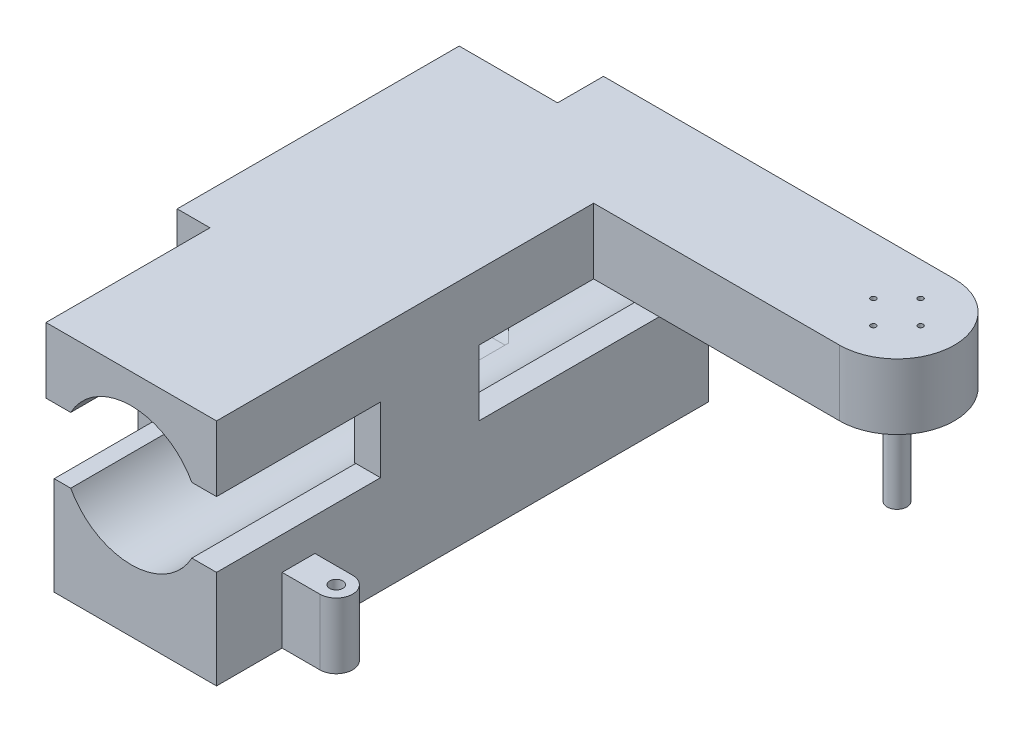
from build123d import *

# Parameters (mm, degrees)
EXTRUDE_1_DEPTH          = 140
EXTRUDE_1_DEPTH_BACK     = 10
SKETCH_2_W               = 52
SKETCH_2_H               = 70
SKETCH_3_W               = 94.267280548
SKETCH_3_H               = 20
CUT_EXTRUDE_1_DEPTH      = 50
SKETCH_4_W               = 2.5
SKETCH_4_H               = 30
CUT_EXTRUDE_2_DEPTH      = 38
EXTRUDE_2_DEPTH          = 20
CUT_EXTRUDE_7_DEPTH      = 152.678113121
CUT_EXTRUDE_7_DEPTH_BACK = 152.678113121
SKETCH_12_R              = 21
SKETCH_14_W              = 100
SKETCH_14_H              = 20
CUT_EXTRUDE_10_DEPTH     = 10
SKETCH_15_W              = 10
SKETCH_15_H              = 70
EXTRUDE_3_DEPTH          = 100
SKETCH_16_W              = 10
SKETCH_16_H              = 30
EXTRUDE_4_DEPTH          = 92
SKETCH_17_R              = 21
CUT_EXTRUDE_11_DEPTH     = 35
SKETCH_20_W              = 14
SKETCH_20_H              = 19
SKETCH_20_H_2            = 42
SKETCH_20_H_3            = 9
SKETCH_20_W_2            = 21
CUT_EXTRUDE_15_DEPTH     = 30
EXTRUDE_5_DEPTH          = 40
SKETCH_23_R              = 21
CUT_EXTRUDE_16_DEPTH     = 35
SKETCH_24_W              = 30
SKETCH_24_H              = 20
EXTRUDE_6_DEPTH          = 8
SKETCH_25_W              = 35
SKETCH_25_H              = 20
EXTRUDE_7_DEPTH          = 75
SKETCH_26_R              = 17.5
EXTRUDE_8_DEPTH          = 20
SKETCH_27_R              = 3
EXTRUDE_9_DEPTH          = 50
M2X0_4_1_D               = 1.6


with BuildPart() as part:
    # ｽｹｯﾁ2 → ﾎﾞｽ - 押し出し1 (new, two sides: drawn at the far end of the back side and taken through both)
    with BuildSketch(Plane.XY.offset(-EXTRUDE_1_DEPTH_BACK)):
        with Locations((0, -5)):
            Rectangle(SKETCH_2_W, SKETCH_2_H)
    extrude(amount=EXTRUDE_1_DEPTH + EXTRUDE_1_DEPTH_BACK)

    # ｽｹｯﾁ3 → ｶｯﾄ - 押し出し1 (cut)
    with BuildSketch(Plane.XY.offset(140)):
        Rectangle(SKETCH_3_W, SKETCH_3_H)
    extrude(amount=-CUT_EXTRUDE_1_DEPTH, mode=Mode.SUBTRACT)

    # ｽｹｯﾁ4 → ｶｯﾄ - 押し出し2 (cut)
    with BuildSketch(Plane.XY.offset(140)):
        with Locations((-24.75, -25)):
            Rectangle(SKETCH_4_W, SKETCH_4_H)
    extrude(amount=-CUT_EXTRUDE_2_DEPTH, mode=Mode.SUBTRACT)

    # ｽｹｯﾁ6 → ﾎﾞｽ - 押し出し2 (add)
    with BuildSketch(Plane(origin=(0, -40, 0), x_dir=(-1, 0, 0), z_dir=(0, -1, 0))):
        with BuildLine():
            Line((-37.5, -120), (-26, -120))
            Line((-26, -120), (-26, -110))
            Line((-26, -110), (-37.5, -110))
            ThreePointArc((-37.5, -110), (-33.964466094, -111.464466094), (-32.5, -115))
            ThreePointArc((-32.5, -115), (-33.964466094, -118.535533906), (-37.5, -120))
        make_face()
        with BuildLine():
            ThreePointArc((-37.5, -110), (-42.5, -115), (-37.5, -120))
            Line((-37.5, -120), (-37.5, -117))
            ThreePointArc((-37.5, -117), (-39.5, -115), (-37.5, -113))
            Line((-37.5, -113), (-37.5, -110))
        make_face()
        with BuildLine():
            Line((-37.5, -117), (-37.5, -120))
            ThreePointArc((-37.5, -120), (-33.964466094, -118.535533906), (-32.5, -115))
            ThreePointArc((-32.5, -115), (-33.964466094, -111.464466094), (-37.5, -110))
            Line((-37.5, -110), (-37.5, -113))
            ThreePointArc((-37.5, -113), (-36.085786438, -113.585786438), (-35.5, -115))
            ThreePointArc((-35.5, -115), (-36.085786438, -116.414213562), (-37.5, -117))
        make_face()
    extrude(amount=-EXTRUDE_2_DEPTH)

    # ｽｹｯﾁ12 → ｶｯﾄ - 押し出し7 (cut, two sides: drawn at the far end of the back side and taken through both)
    with BuildSketch(Plane.XY.offset(-CUT_EXTRUDE_7_DEPTH_BACK)):
        Circle(SKETCH_12_R)
    extrude(amount=CUT_EXTRUDE_7_DEPTH + CUT_EXTRUDE_7_DEPTH_BACK, mode=Mode.SUBTRACT)

    # ｽｹｯﾁ14 → ｶｯﾄ - 押し出し10 (cut)
    with BuildSketch(Plane(origin=(26, 0, 0), x_dir=(0, 0, -1), z_dir=(1, 0, 0))):
        with Locations((-40, 0)):
            Rectangle(SKETCH_14_W, SKETCH_14_H)
    extrude(amount=-CUT_EXTRUDE_10_DEPTH, mode=Mode.SUBTRACT)

    # ｽｹｯﾁ15 → ﾎﾞｽ - 押し出し3 (add)
    with BuildSketch(Plane(origin=(0, 0, -10), x_dir=(-1, 0, 0), z_dir=(0, 0, -1))):
        with Locations((31, -5)):
            Rectangle(SKETCH_15_W, SKETCH_15_H)
    extrude(amount=-EXTRUDE_3_DEPTH)

    # ｽｹｯﾁ16 → ﾎﾞｽ - 押し出し4 (add)
    with BuildSketch(Plane(origin=(0, 0, -10), x_dir=(-1, 0, 0), z_dir=(0, 0, -1))):
        with Locations((31, -25)):
            Rectangle(SKETCH_16_W, SKETCH_16_H)
    extrude(amount=-EXTRUDE_4_DEPTH)

    # ｽｹｯﾁ17 → ｶｯﾄ - 押し出し11 (cut)
    with BuildSketch(Plane.ZY.offset(36)):
        with Locations(Location((25, 0, 0), (0, 0, 270))):
            Circle(SKETCH_17_R)
    extrude(amount=-CUT_EXTRUDE_11_DEPTH, mode=Mode.SUBTRACT)

    # ｽｹｯﾁ20 → ｶｯﾄ - 押し出し15 (cut)
    with BuildSketch(Plane.ZY.offset(36)):
        with Locations((-3, -30.5)):
            Rectangle(SKETCH_20_W, SKETCH_20_H)
        with Locations((-3, 0)):
            Rectangle(SKETCH_20_W, SKETCH_20_H_2)
        with Locations((-3, 25.5)):
            Rectangle(SKETCH_20_W, SKETCH_20_H_3)
        with Locations((14.5, 0)):
            Rectangle(SKETCH_20_W_2, SKETCH_20_H_2)
    extrude(amount=-CUT_EXTRUDE_15_DEPTH, mode=Mode.SUBTRACT)

    # ｽｹｯﾁ22 → ﾎﾞｽ - 押し出し5 (add)
    with BuildSketch(Plane.XY.offset(102)):
        Polygon((-36, -40), (-26, -40.058181949), (-26, -10), (-36, -10), align=None)
    extrude(amount=-EXTRUDE_5_DEPTH)

    # ｽｹｯﾁ23 → ｶｯﾄ - 押し出し16 (cut)
    with BuildSketch(Plane.ZY.offset(36)):
        with Locations((46, 0)):
            Circle(SKETCH_23_R)
        with BuildLine():
            ThreePointArc((25, -6e-09), (31.150757593, 14.849242403), (46, 21))
            Line((46, 21), (25, 21))
            Line((25, 21), (25, -6e-09))
        make_face()
        with BuildLine():
            ThreePointArc((46, -21), (31.150757597, -14.849242407), (25, -6e-09))
            Line((25, -6e-09), (25, -21))
            Line((25, -21), (46, -21))
        make_face()
    extrude(amount=-CUT_EXTRUDE_16_DEPTH, mode=Mode.SUBTRACT)

    # ｽｹｯﾁ24 → ﾎﾞｽ - 押し出し6 (add)
    with BuildSketch(Plane(origin=(26, 0, 0), x_dir=(0, 0, -1), z_dir=(1, 0, 0))):
        with Locations((-75, 0)):
            Rectangle(SKETCH_24_W, SKETCH_24_H)
    extrude(amount=-EXTRUDE_6_DEPTH)

    # ｽｹｯﾁ25 → ﾎﾞｽ - 押し出し7 (add)
    with BuildSketch(Plane(origin=(26, 0, 0), x_dir=(0, 0, -1), z_dir=(1, 0, 0))):
        with Locations((-7.5, 20)):
            Rectangle(SKETCH_25_W, SKETCH_25_H)
    extrude(amount=EXTRUDE_7_DEPTH)

    # ｽｹｯﾁ26 → ﾎﾞｽ - 押し出し8 (add)
    with BuildSketch(Plane(origin=(0, 30, 0), x_dir=(1, 0, 0), z_dir=(0, 1, 0))):
        with Locations((101, -7.5)):
            Circle(SKETCH_26_R)
    extrude(amount=-EXTRUDE_8_DEPTH)

    # ｽｹｯﾁ27 → ﾎﾞｽ - 押し出し9 (add)
    with BuildSketch(Plane(origin=(0, 30, 0), x_dir=(1, 0, 0), z_dir=(0, 1, 0))):
        with Locations(Location((101, -7.5, 0), (0, 0, 270))):
            Circle(SKETCH_27_R)
    extrude(amount=-EXTRUDE_9_DEPTH)

    # M2x0.4 ねじ穴1 (through all)
    with Locations(Plane(origin=(0, 30, 0), x_dir=(1, 0, 0), z_dir=(0, 1, 0))):
        with Locations((101, -0.3), (101, -14.7), (108.2, -7.5), (93.8, -7.5)):
            Hole(M2X0_4_1_D / 2)


solid = part.part
